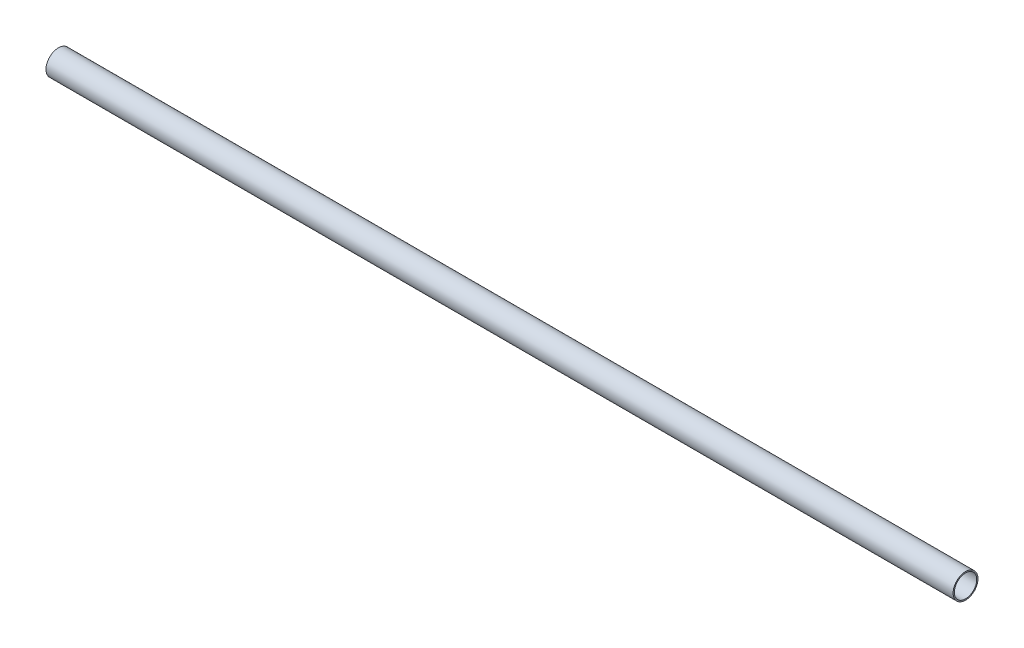
from build123d import *

# Parameters (mm, degrees)
SKETCH1_R           = 10
SKETCH1_R_2         = 9
BOSS_EXTRUDE1_DEPTH = 729


with BuildPart() as part:
    # Sketch1 → Boss-Extrude1 (new body)
    with BuildSketch(Plane(origin=(0, 0, 0), x_dir=(0, 0, -1), z_dir=(1, 0, 0))):
        Circle(SKETCH1_R)
        Circle(SKETCH1_R_2, mode=Mode.SUBTRACT)
    extrude(amount=BOSS_EXTRUDE1_DEPTH)


solid = part.part
